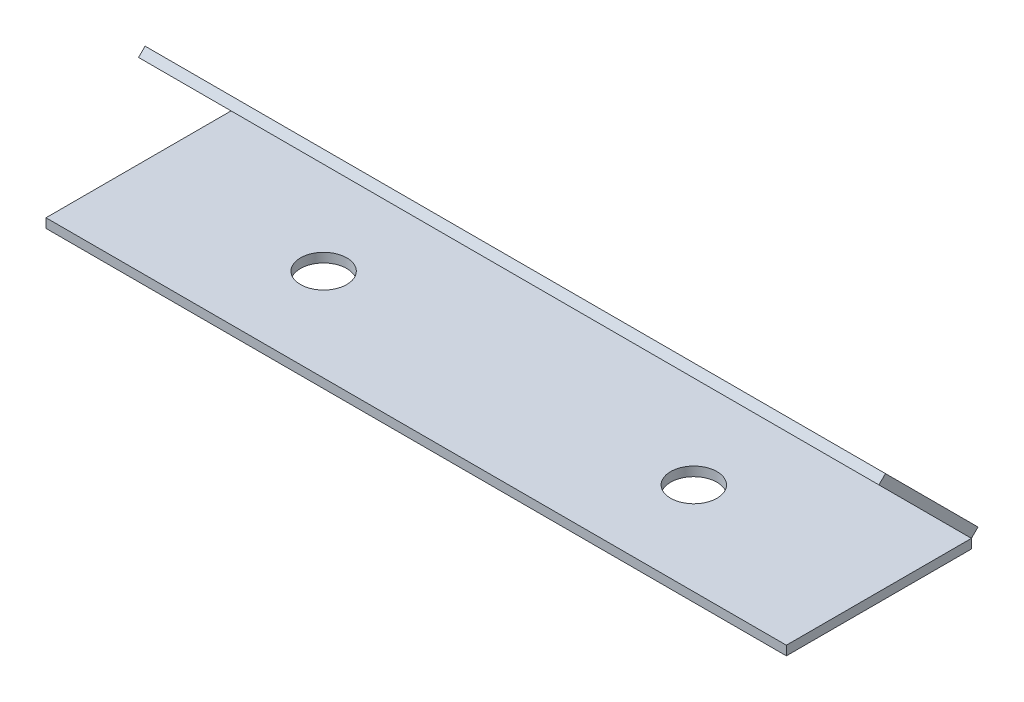
from build123d import *

# Parameters (mm, degrees)
SKETCH2_W           = 20
SKETCH2_H           = 5
SKETCH2_R           = 0.625
BOSS_EXTRUDE1_DEPTH = 0.25
SKETCH5_W           = 20
SKETCH5_H           = 3.535533906
SKETCH5_R           = 0.625
BOSS_EXTRUDE5_DEPTH = 0.25


with BuildPart() as part:
    # Sketch2 → Boss-Extrude1 (new body)
    with BuildSketch(Plane(origin=(0, 0, 0), x_dir=(1, 0, 0), z_dir=(0, 1, 0))):
        Rectangle(SKETCH2_W, SKETCH2_H)
        with Locations(Location((-5, 0, 0), (0, 0, 270))):
            Circle(SKETCH2_R, mode=Mode.SUBTRACT)
        with Locations(Location((5, 0, 0), (0, 0, 270))):
            Circle(SKETCH2_R, mode=Mode.SUBTRACT)
    extrude(amount=BOSS_EXTRUDE1_DEPTH)


with BuildPart() as body_2:
    # Sketch5 → Boss-Extrude5 (new body)
    with BuildSketch(Plane(origin=(0, 1.375, -1.375), x_dir=(-1, 0, 0), z_dir=(0, 0.7071067811865464, -0.7071067811865488))):
        with Locations((0, 0.176776695)):
            Rectangle(SKETCH5_W, SKETCH5_H)
        with Locations(Location((-4.98869427, 0, 0), (0, 0, 90))):
            Circle(SKETCH5_R, mode=Mode.SUBTRACT)
        with Locations(Location((5.01130573, 0, 0), (0, 0, 90))):
            Circle(SKETCH5_R, mode=Mode.SUBTRACT)
    extrude(amount=BOSS_EXTRUDE5_DEPTH)


solid = Compound([part.part, body_2.part])
